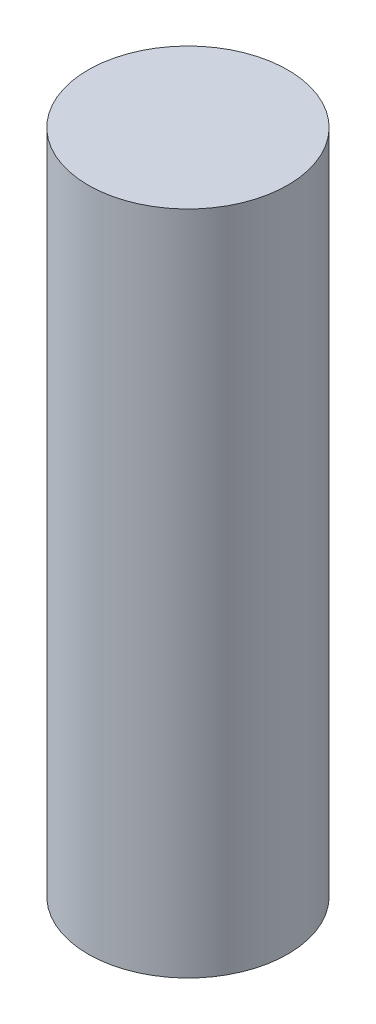
from build123d import *

# Parameters (mm, degrees)
IZIM1_R                     = 7.495
Y_KSEKLIK_EKSTR_ZYON1_DEPTH = 50


with BuildPart() as part:
    # Çizim1 → Yükseklik-Ekstrüzyon1 (new body)
    with BuildSketch(Plane(origin=(0, 0, 0), x_dir=(1, 0, 0), z_dir=(0, 1, 0))):
        with Locations(Location((0, 0, 0), (0, 0, 270))):
            Circle(IZIM1_R)
    extrude(amount=Y_KSEKLIK_EKSTR_ZYON1_DEPTH)


solid = part.part
